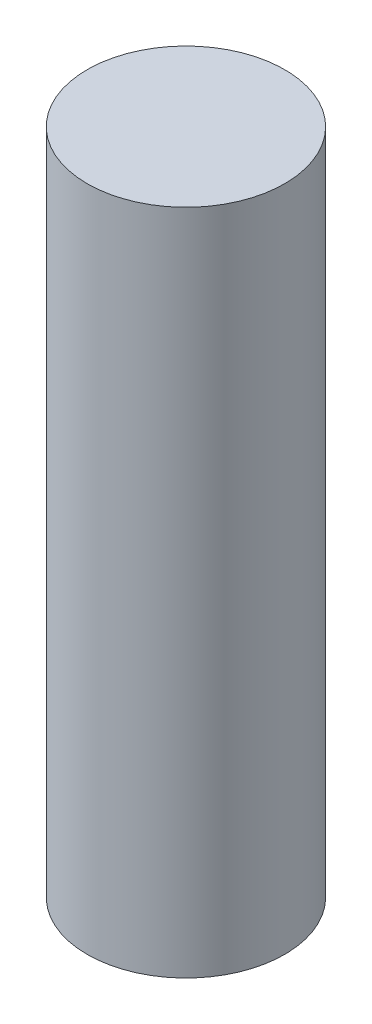
from build123d import *

# Parameters (mm, degrees)
SKETCH1_R           = 14.8
BOSS_EXTRUDE1_DEPTH = 100


with BuildPart() as part:
    # Sketch1 → Boss-Extrude1 (new body)
    with BuildSketch(Plane(origin=(0, 0, 0), x_dir=(1, 0, 0), z_dir=(0, 1, 0))):
        with Locations(Location((0, 0, 0), (0, 0, 270))):
            Circle(SKETCH1_R)
    extrude(amount=BOSS_EXTRUDE1_DEPTH)


solid = part.part
